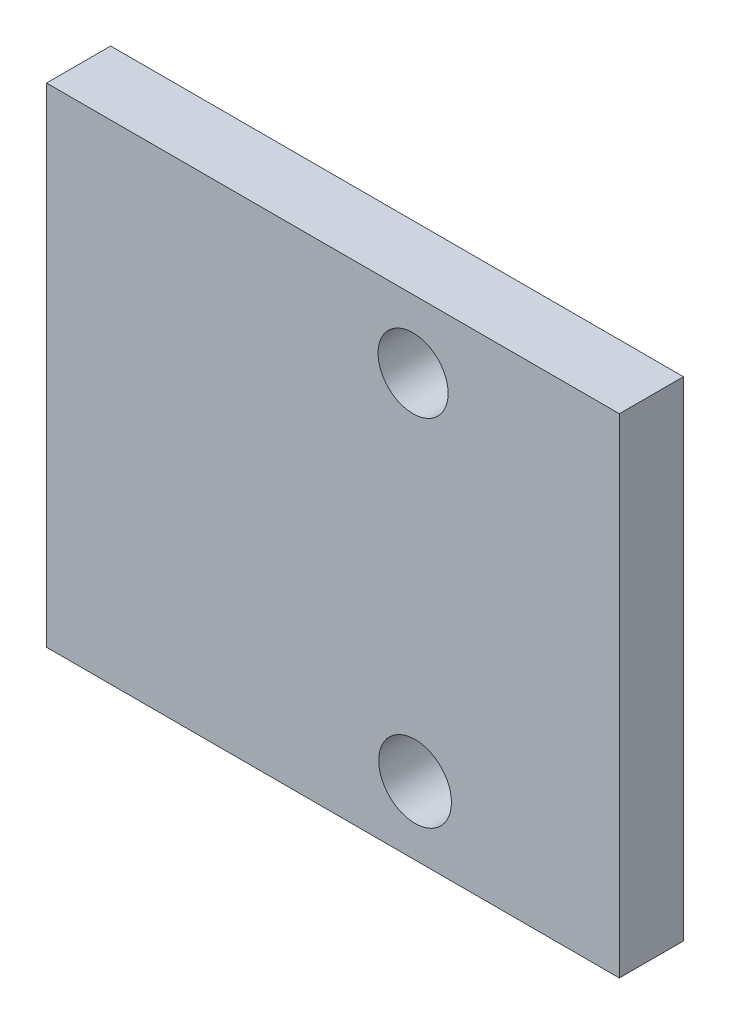
from build123d import *

# Parameters (mm, degrees)
SKETCH_1_W      = 14.3
SKETCH_1_H      = 12.2
SKETCH_1_R      = 0.875
SKETCH_1_R_2    = 0.907902719
EXTRUDE_1_DEPTH = 1.6
SKETCH_2_W      = 5.000412462
SKETCH_2_H      = 5.000412462
EXTRUDE_2_DEPTH = 1.6


with BuildPart() as part:
    # 草图1 → 凸台-拉伸1 (new body)
    with BuildSketch(Plane.XY):
        Rectangle(SKETCH_1_W, SKETCH_1_H)
        with Locations((2, 4.399857953)):
            Circle(SKETCH_1_R, mode=Mode.SUBTRACT)
        with Locations((2.05, -4.4)):
            Circle(SKETCH_1_R_2, mode=Mode.SUBTRACT)
    extrude(amount=EXTRUDE_1_DEPTH)

    # 草图2 → 凸台-拉伸2 (add)
    with BuildSketch(Plane(origin=(0, 0, 0), x_dir=(-1, 0, 0), z_dir=(0, 0, -1))):
        Rectangle(SKETCH_2_W, SKETCH_2_H)
    extrude(amount=EXTRUDE_2_DEPTH)


solid = part.part
